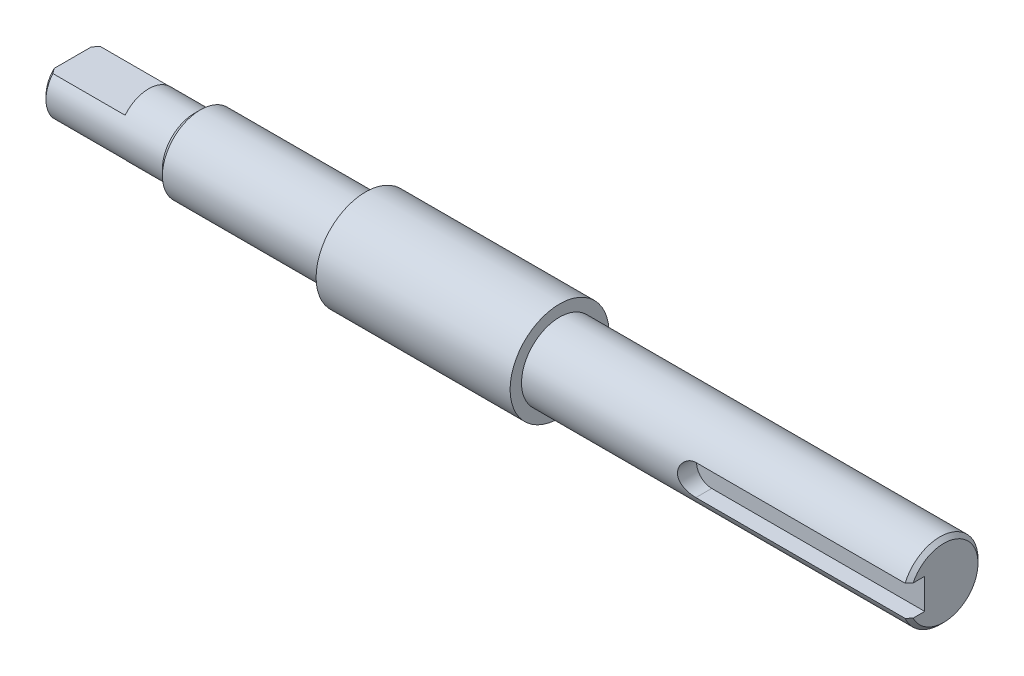
from build123d import *

# Parameters (mm, degrees)
CUT_EXTRUDE1_START = -10
CUT_EXTRUDE1_DEPTH = 10
CUT_EXTRUDE2_DEPTH = 2.5
CHAMFER1_SIZE      = 0.8
CHAMFER2_SIZE      = 0.5


with BuildPart() as part:
    # Sketch1 → Revolve1 (revolve)
    with BuildSketch(Plane.XY, mode=Mode.PRIVATE) as revolve1_sk:
        Polygon((-38.5, 0), (-38.5, 4), (-22.5, 4), (-22.5, 5), (0, 5), (0, 6.5), (25.5, 6.5), (25.5, 5), (76, 5), (76, 0), align=None)
    revolve(revolve1_sk.sketch.rotate(Axis((-44.194465138, 0, 0), (1, 0, 0)), 90), axis=Axis((-44.194465138, 0, 0), (1, 0, 0)))

    # Sketch2 → Cut-Extrude1 (cut)
    with BuildSketch(Plane.ZY.offset(38.5).offset(CUT_EXTRUDE1_START)):
        with BuildLine():
            Line((-3.1, -2.527844932), (3.1, -2.527844932))
            ThreePointArc((3.1, -2.527844932), (0, -4), (-3.1, -2.527844932))
        make_face()
        with BuildLine():
            Line((-3.1, 2.527844932), (3.1, 2.527844932))
            ThreePointArc((3.1, 2.527844932), (0, 4), (-3.1, 2.527844932))
        make_face()
    extrude(amount=CUT_EXTRUDE1_DEPTH, mode=Mode.SUBTRACT)

    # Sketch3 → Cut-Extrude2 (cut)
    with BuildSketch(Plane.XY.offset(5)):
        with BuildLine():
            Line((76, -2), (48, -2))
            ThreePointArc((48, -2), (46, 0), (48, 2))
            Line((48, 2), (76, 2))
            ThreePointArc((76, 2), (78, 0), (76, -2))
        make_face()
    extrude(amount=-CUT_EXTRUDE2_DEPTH, mode=Mode.SUBTRACT)

    # Chamfer1
    chamfer1_edges = [part.edges().sort_by_distance(p)[0] for p in [
        (-22.5, 0, -5),
    ]]
    chamfer(chamfer1_edges, length=CHAMFER1_SIZE)

    # Chamfer2
    chamfer2_edges = [part.edges().sort_by_distance(p)[0] for p in [
        (-38.5, -1.341640786, 3.768288736),
        (-38.5, 0, -4),
        (76, 0, -5),
    ]]
    chamfer(chamfer2_edges, length=CHAMFER2_SIZE)


solid = part.part
